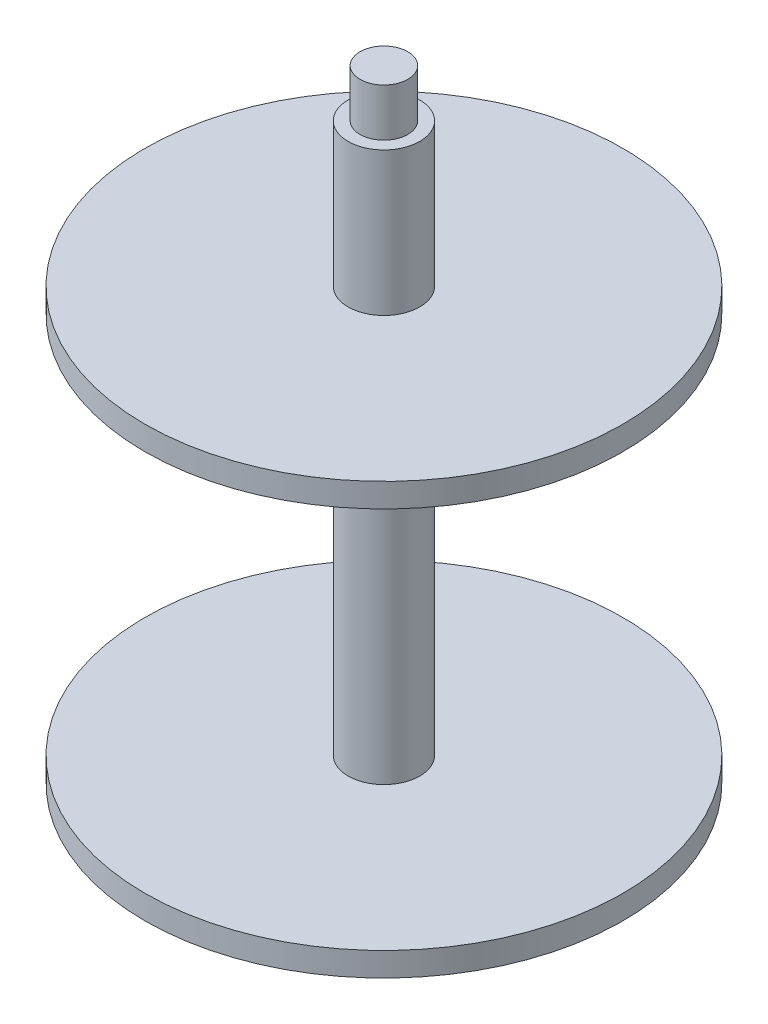
from build123d import *

# Parameters (mm, degrees)
SKETCH1_R           = 7.5
BOSS_EXTRUDE1_DEPTH = 160
BOSS_EXTRUDE2_START = 35
SKETCH1_3_R         = 50
BOSS_EXTRUDE2_DEPTH = 5
BOSS_EXTRUDE3_START = 115
SKETCH1_4_R         = 50
SKETCH1_4_R_2       = 7.5
BOSS_EXTRUDE3_DEPTH = 5
CUT_EXTRUDE1_START  = -10
SKETCH2_R           = 7.5
SKETCH2_R_2         = 5
CUT_EXTRUDE1_DEPTH  = 10


with BuildPart() as part:
    # Sketch1 → Boss-Extrude1 (new body)
    with BuildSketch(Plane(origin=(0, 0, 0), x_dir=(1, 0, 0), z_dir=(0, 1, 0))):
        Circle(SKETCH1_R)
    extrude(amount=BOSS_EXTRUDE1_DEPTH)

    # Sketch1<3> → Boss-Extrude2 (add)
    with BuildSketch(Plane(origin=(0, 0, 0), x_dir=(1, 0, 0), z_dir=(0, 1, 0)).offset(BOSS_EXTRUDE2_START)):
        Circle(SKETCH1_3_R)
    extrude(amount=-BOSS_EXTRUDE2_DEPTH)

    # Sketch1<4> → Boss-Extrude3 (add)
    with BuildSketch(Plane(origin=(0, 0, 0), x_dir=(1, 0, 0), z_dir=(0, 1, 0)).offset(BOSS_EXTRUDE3_START)):
        Circle(SKETCH1_4_R)
        Circle(SKETCH1_4_R_2, mode=Mode.SUBTRACT)
    extrude(amount=BOSS_EXTRUDE3_DEPTH)

    # Sketch2 → Cut-Extrude1 (cut)
    with BuildSketch(Plane(origin=(0, 160, 0), x_dir=(1, 0, 0), z_dir=(0, 1, 0)).offset(CUT_EXTRUDE1_START)):
        Circle(SKETCH2_R)
        Circle(SKETCH2_R_2, mode=Mode.SUBTRACT)
    extrude(amount=CUT_EXTRUDE1_DEPTH, mode=Mode.SUBTRACT)


solid = part.part
